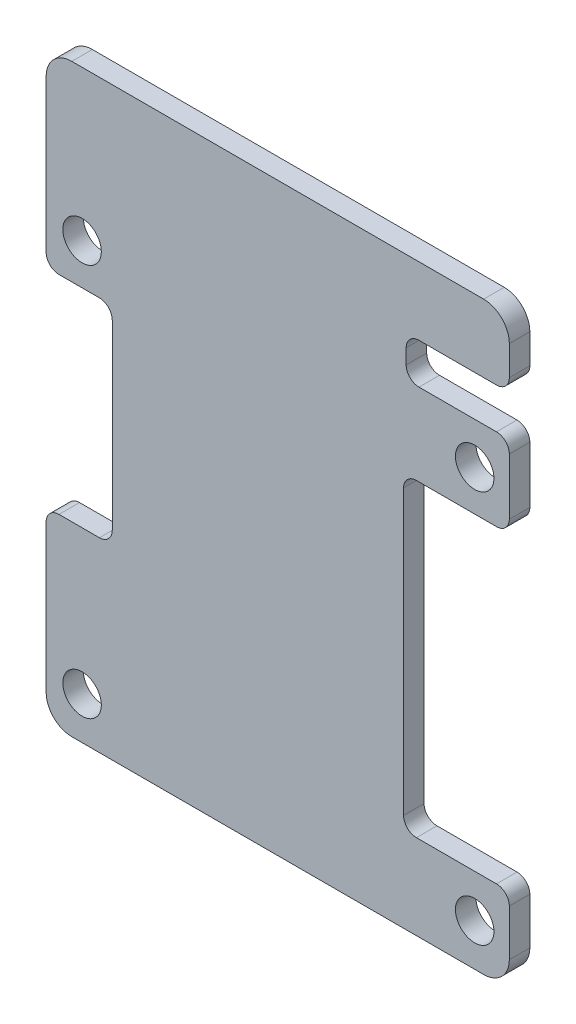
from build123d import *

# Parameters (mm, degrees)
BOARD3_R        = 1.5
EXTRUDE_4_DEPTH = 1.6


with BuildPart() as part:
    # Board3 → Бобышка-Вытянуть4 (new body)
    with BuildSketch(Plane.XY):
        with BuildLine():
            Line((12.870855766, 54), (44.970855766, 54))
            ThreePointArc((44.970855766, 54), (46.385069328, 53.414213562), (46.970855766, 52))
            Line((46.970855766, 52), (46.970855766, 49.700569912))
            ThreePointArc((46.970855766, 49.700569912), (46.677962547, 48.993463131), (45.970855766, 48.700569912))
            Line((45.970855766, 48.700569912), (39.93144499, 48.700569912))
            ThreePointArc((39.93144499, 48.700569912), (39.224338209, 48.407676693), (38.93144499, 47.700569912))
            Line((38.93144499, 47.700569912), (38.93144499, 46.541193448))
            ThreePointArc((38.93144499, 46.541193448), (39.224338209, 45.834086667), (39.93144499, 45.541193448))
            Line((39.93144499, 45.541193448), (45.970855766, 45.541193448))
            ThreePointArc((45.970855766, 45.541193448), (46.677962547, 45.248300229), (46.970855766, 44.541193448))
            Line((46.970855766, 44.541193448), (46.970855766, 40.140550153))
            ThreePointArc((46.970855766, 40.140550153), (46.677962547, 39.433443372), (45.970855766, 39.140550153))
            Line((45.970855766, 39.140550153), (39.728596312, 39.140550153))
            ThreePointArc((39.728596312, 39.140550153), (39.021489531, 38.847656935), (38.728596312, 38.140550153))
            Line((38.728596312, 38.140550153), (38.728596312, 16.029234453))
            ThreePointArc((38.728596312, 16.029234453), (39.021489531, 15.322127672), (39.728596312, 15.029234453))
            Line((39.728596312, 15.029234453), (45.970855766, 15.029234453))
            ThreePointArc((45.970855766, 15.029234453), (46.677962547, 14.736341234), (46.970855766, 14.029234453))
            Line((46.970855766, 14.029234453), (46.970855766, 10.412381856))
            ThreePointArc((46.970855766, 10.412381856), (46.385069328, 8.998168294), (44.970855766, 8.412381856))
            Line((44.970855766, 8.412381856), (12.870855766, 8.412381856))
            ThreePointArc((12.870855766, 8.412381856), (11.456642203, 8.998168294), (10.870855766, 10.412381856))
            Line((10.870855766, 10.412381856), (10.870855766, 21.919777804))
            ThreePointArc((10.870855766, 21.919777804), (11.163748985, 22.626884585), (11.870855766, 22.919777804))
            Line((11.870855766, 22.919777804), (15.023151862, 22.919777804))
            ThreePointArc((15.023151862, 22.919777804), (15.730258643, 23.212671023), (16.023151862, 23.919777804))
            Line((16.023151862, 23.919777804), (16.023151862, 38.110742779))
            ThreePointArc((16.023151862, 38.110742779), (15.730258643, 38.81784956), (15.023151862, 39.110742779))
            Line((15.023151862, 39.110742779), (11.870855766, 39.110742779))
            ThreePointArc((11.870855766, 39.110742779), (11.163748985, 39.403635998), (10.870855766, 40.110742779))
            Line((10.870855766, 40.110742779), (10.870855766, 52))
            ThreePointArc((10.870855766, 52), (11.456642203, 53.414213562), (12.870855766, 54))
        make_face()
        with Locations((13.670855766, 42.3)):
            Circle(BOARD3_R, mode=Mode.SUBTRACT)
        with Locations((44.270855766, 42.3)):
            Circle(BOARD3_R, mode=Mode.SUBTRACT)
        with Locations((13.670855766, 11.7)):
            Circle(BOARD3_R, mode=Mode.SUBTRACT)
        with Locations((44.270855766, 11.7)):
            Circle(BOARD3_R, mode=Mode.SUBTRACT)
    extrude(amount=EXTRUDE_4_DEPTH)


solid = part.part
